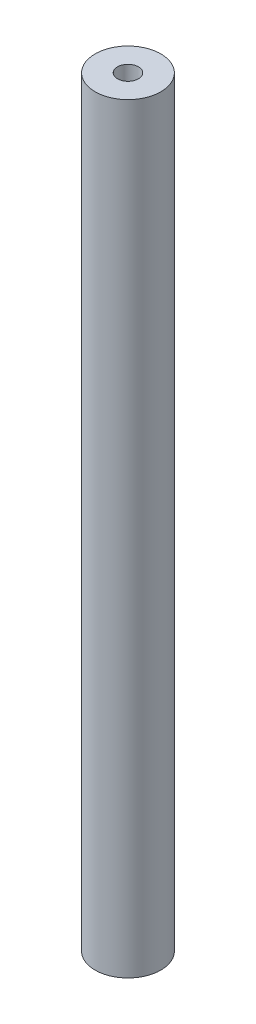
from build123d import *

# Parameters (mm, degrees)
SKETCH1_R           = 6.35
BOSS_EXTRUDE1_DEPTH = 73.533


with BuildPart() as part:
    # Sketch1 → Boss-Extrude1 (new, symmetric)
    with BuildSketch(Plane(origin=(0, 0, 0), x_dir=(1, 0, 0), z_dir=(0, 1, 0))):
        with Locations(Location((0, 0, 0), (0, 0, 270))):
            Circle(SKETCH1_R)
    extrude(amount=BOSS_EXTRUDE1_DEPTH, both=True)

    # Sketch2 → #10-32 Tapped Hole1 (revolve, cut)
    with BuildSketch(Plane(origin=(0, 73.533, 0), x_dir=(0, 0, 1), z_dir=(1, 0, 0))):
        Polygon((0, 0), (0, 13.151317848), (2.0193, 11.938), (2.0193, 0), align=None)
    f_10_32_tapped_hole1 = revolve(axis=Axis((0, 79.883, 0), (0, -1, 0)), mode=Mode.SUBTRACT)

    # Mirror1: #10-32 Tapped Hole1 across plane
    add(f_10_32_tapped_hole1.mirror(Plane.ZX), mode=Mode.SUBTRACT)


solid = part.part
